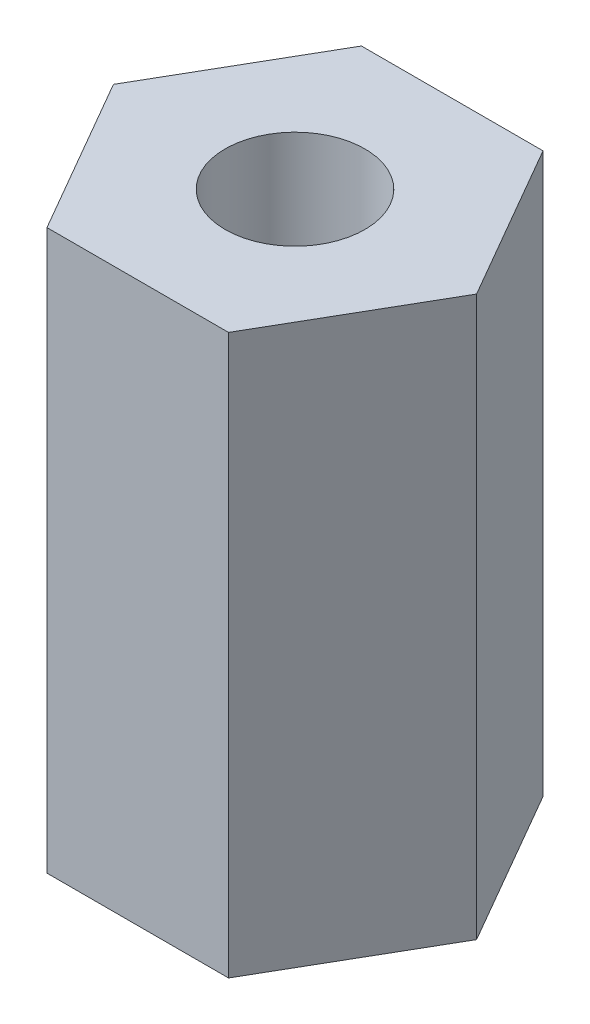
from build123d import *

# Parameters (mm, degrees)
SKETCH1_R           = 1.27
BOSS_EXTRUDE1_DEPTH = 5.08


with BuildPart() as part:
    # Sketch1 → Boss-Extrude1 (new, symmetric)
    with BuildSketch(Plane(origin=(0, 0, 0), x_dir=(1, 0, 0), z_dir=(0, 1, 0))):
        Polygon((1.649778394, -2.8575), (3.299556788, 0), (1.649778394, 2.8575), (-1.649778394, 2.8575), (-3.299556788, 0), (-1.649778394, -2.8575), align=None)
        with Locations(Location((0, 0, 0), (0, 0, 270))):
            Circle(SKETCH1_R, mode=Mode.SUBTRACT)
    extrude(amount=BOSS_EXTRUDE1_DEPTH, both=True)


solid = part.part
